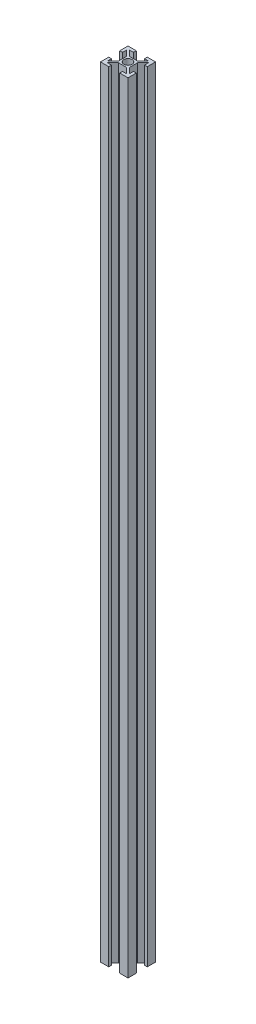
from build123d import *

# Parameters (mm, degrees)
BOSS_EXTRUDE1_START = -12.168666
F_2020_SKETCH_R     = 3
BOSS_EXTRUDE1_DEPTH = 566.038868


with BuildPart() as part:
    # 2020 sketch → Boss-Extrude1 (new body)
    with BuildSketch(Plane(origin=(0, 0, 0), x_dir=(1, 0, 0), z_dir=(0, 1, 0)).offset(BOSS_EXTRUDE1_START)):
        Polygon((-4, 10), (-4, 8), (-7, 8), (-3, 4), (3, 4), (7, 8), (4, 8), (4, 10), (10, 10), (10, 4), (8, 4), (8, 7), (4, 3), (4, -3), (8, -7), (8, -4), (10, -4), (10, -10), (4, -10), (4, -8), (7, -8), (3, -4), (-3, -4), (-7, -8), (-4, -8), (-4, -10), (-10, -10), (-10, -4), (-8, -4), (-8, -7), (-4, -3), (-4, 3), (-8, 7), (-8, 4), (-10, 4), (-10, 10), align=None)
        with Locations(Location((0, 0, 0), (0, 0, 270))):
            Circle(F_2020_SKETCH_R, mode=Mode.SUBTRACT)
    extrude(amount=BOSS_EXTRUDE1_DEPTH)


solid = part.part
